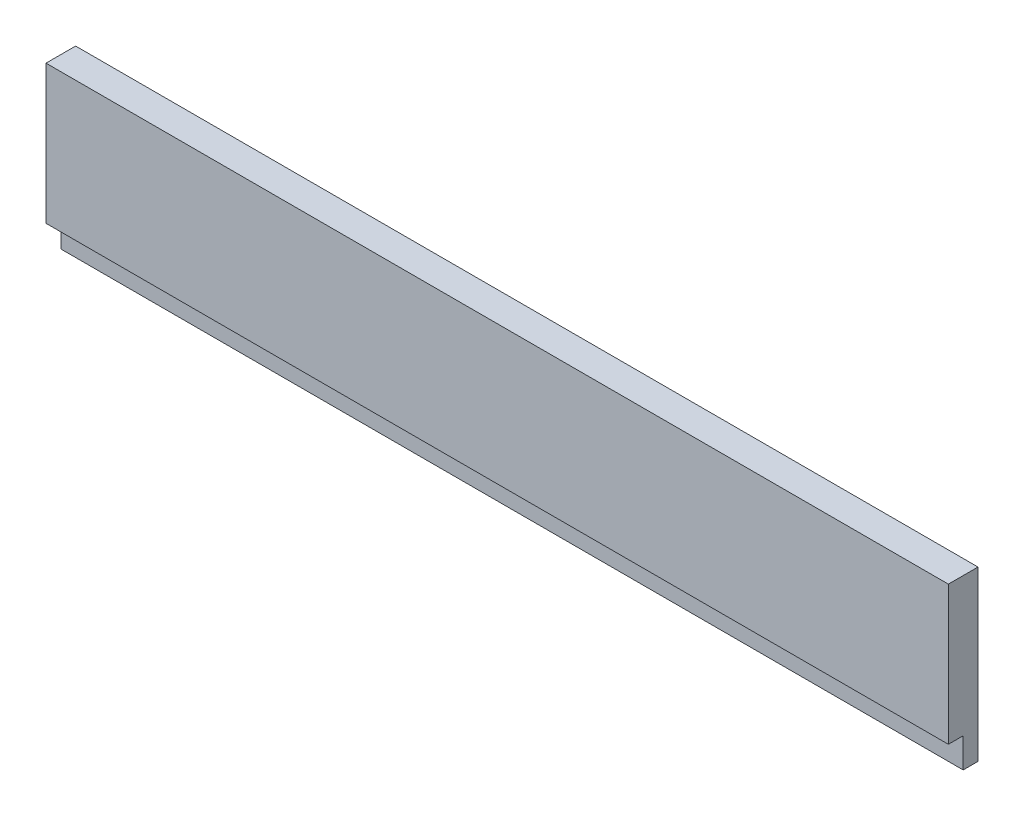
from build123d import *

# Parameters (mm, degrees)
CROQUIS1_W              = 670
CROQUIS1_H              = 125
SALIENTE_EXTRUIR1_DEPTH = 22
CROQUIS2_W              = 11
CROQUIS2_H              = 22
CORTAR_EXTRUIR1_DEPTH   = 676.706056466


with BuildPart() as part:
    # Croquis1 → Saliente-Extruir1 (new body)
    with BuildSketch(Plane.XY):
        with Locations((200.670606996, 22.321428571)):
            Rectangle(CROQUIS1_W, CROQUIS1_H)
    extrude(amount=SALIENTE_EXTRUIR1_DEPTH)

    # Croquis2 → Cortar-Extruir1 (cut, through all)
    with BuildSketch(Plane.ZY.offset(134.329393004)):
        with Locations((16.5, -29.178571429)):
            Rectangle(CROQUIS2_W, CROQUIS2_H)
    extrude(amount=-CORTAR_EXTRUIR1_DEPTH, mode=Mode.SUBTRACT)


solid = part.part
